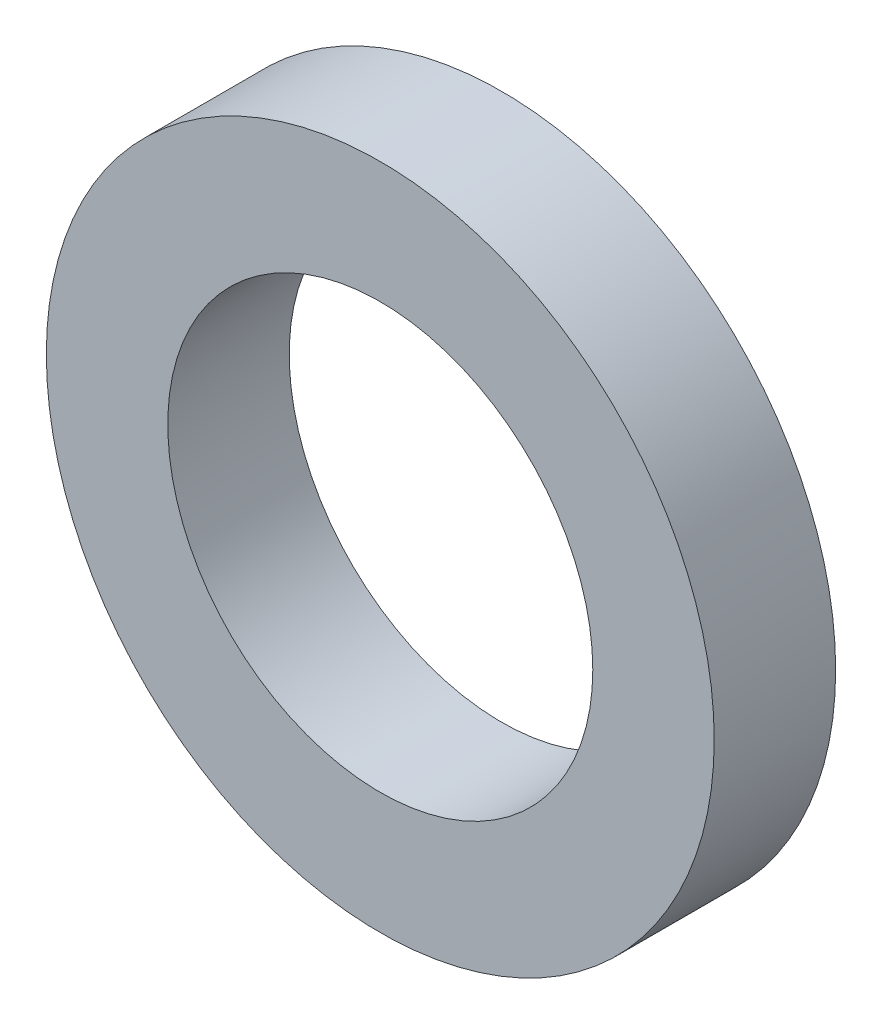
from build123d import *

# Parameters (mm, degrees)
ESQUISSE1_R        = 5.5
ESQUISSE1_R_2      = 3.5
BOSS_EXTRU_1_DEPTH = 2


with BuildPart() as part:
    # Esquisse1 → Boss.-Extru.1 (new body)
    with BuildSketch(Plane.XY):
        Circle(ESQUISSE1_R)
        Circle(ESQUISSE1_R_2, mode=Mode.SUBTRACT)
    extrude(amount=BOSS_EXTRU_1_DEPTH)


solid = part.part
